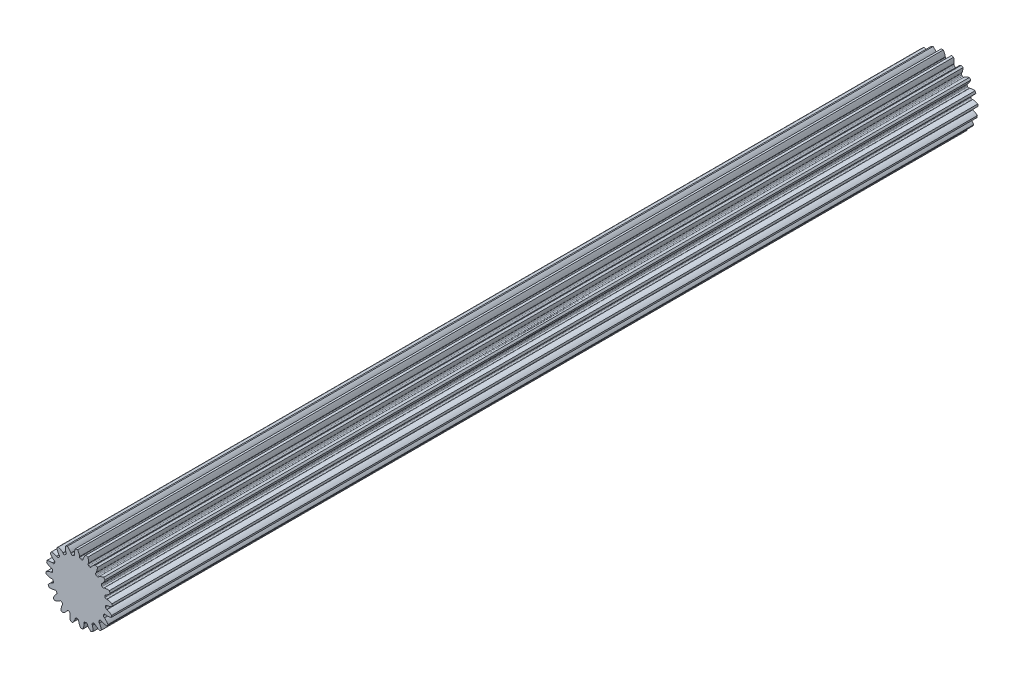
from build123d import *

# Parameters (mm, degrees)
SKETCH1_R                = 11.684
BOSS_EXTRUDE1_DEPTH      = 304.8
CUT_EXTRUDE1_DEPTH       = 306.247558077
FILLET1_R                = 0.415441257
CIRPATTERN1_COUNT        = 20
FILLET1_OF_CIRPATTERN1_R = 0.415441257


with BuildPart() as part:
    # Sketch1 → Boss-Extrude1 (new body)
    with BuildSketch(Plane.XY):
        Circle(SKETCH1_R)
    extrude(amount=-BOSS_EXTRUDE1_DEPTH)

    # Sketch4 → Cut-Extrude1 (cut, through all)
    with BuildSketch(Plane.XY):
        with BuildLine():
            Line((0.172809671, 9.939600085), (0.172809671, 9.353501902))
            ThreePointArc((0.172809671, 9.353501902), (0.733994253, 9.32625935), (1.292531372, 9.265377686))
            Line((1.292531372, 9.265377686), (1.384217541, 9.844259995))
            add(Edge.make_bspline(
                [(3.488297689, 12.366679075), (1.959058595, 11.402998329), (1.384217541, 9.844259995)],
                knots=[0, 0, 0, 1, 1, 1], degree=2))
            ThreePointArc((3.488297689, 12.366679075), (1.008142115, 12.809630034), (-1.510771443, 12.760115272))
            add(Edge.make_bspline(
                [(-1.510771443, 12.760115272), (-0.15111314, 11.569072837), (0.172809671, 9.939600085)],
                knots=[0, 0, 0, 1, 1, 1], degree=2))
        make_face()
    cut_extrude1 = extrude(amount=-CUT_EXTRUDE1_DEPTH, mode=Mode.SUBTRACT)

    # Fillet1
    fillet1_edges = [part.edges().sort_by_distance(p)[0] for p in [
        (1.292531372, 9.265377686, -152.4),
        (0.172809671, 9.353501902, -152.4),
    ]]
    fillet(fillet1_edges, radius=FILLET1_R)

    # CirPattern1: Cut-Extrude1 ×20 about axis
    cirpattern1_axis = Axis((0, 0, -304.8), (0, 0, 1))
    for i in range(1, CIRPATTERN1_COUNT):
        add(cut_extrude1.rotate(cirpattern1_axis, i * 360 / CIRPATTERN1_COUNT), mode=Mode.SUBTRACT)

    # Fillet1 of CirPattern1
    fillet1_of_cirpattern1_edges = [part.edges().sort_by_distance(p)[0] for p in [
        (-1.63388878, 9.211311985, -152.4),
        (-2.726039281, 8.94911006, -152.4),
        (-4.400372515, 8.255578887, -152.4),
        (-5.358044515, 7.668716972, -152.4),
        (-6.736117129, 6.491732207, -152.4),
        (-7.46556702, 5.637656436, -152.4),
        (-8.412483665, 4.092429549, -152.4),
        (-8.842307809, 3.054742809, -152.4),
        (-9.265377686, 1.292531372, -152.4),
        (-9.353501902, 0.172809671, -152.4),
        (-9.211311985, -1.63388878, -152.4),
        (-8.94911006, -2.726039281, -152.4),
        (-8.255578887, -4.400372515, -152.4),
        (-7.668716972, -5.358044515, -152.4),
        (-6.491732207, -6.736117129, -152.4),
        (-5.637656436, -7.46556702, -152.4),
        (-4.092429549, -8.412483665, -152.4),
        (-3.054742809, -8.842307809, -152.4),
        (-1.292531372, -9.265377686, -152.4),
        (-0.172809671, -9.353501902, -152.4),
        (1.63388878, -9.211311985, -152.4),
        (2.726039281, -8.94911006, -152.4),
        (4.400372515, -8.255578887, -152.4),
        (5.358044515, -7.668716972, -152.4),
        (6.736117129, -6.491732207, -152.4),
        (7.46556702, -5.637656436, -152.4),
        (8.412483665, -4.092429549, -152.4),
        (8.842307809, -3.054742809, -152.4),
        (9.265377686, -1.292531372, -152.4),
        (9.353501902, -0.172809671, -152.4),
        (9.211311985, 1.63388878, -152.4),
        (8.94911006, 2.726039281, -152.4),
        (8.255578887, 4.400372515, -152.4),
        (7.668716972, 5.358044515, -152.4),
        (6.491732207, 6.736117129, -152.4),
        (5.637656436, 7.46556702, -152.4),
        (4.092429549, 8.412483665, -152.4),
        (3.054742809, 8.842307809, -152.4),
    ]]
    fillet(fillet1_of_cirpattern1_edges, radius=FILLET1_OF_CIRPATTERN1_R)


solid = part.part
